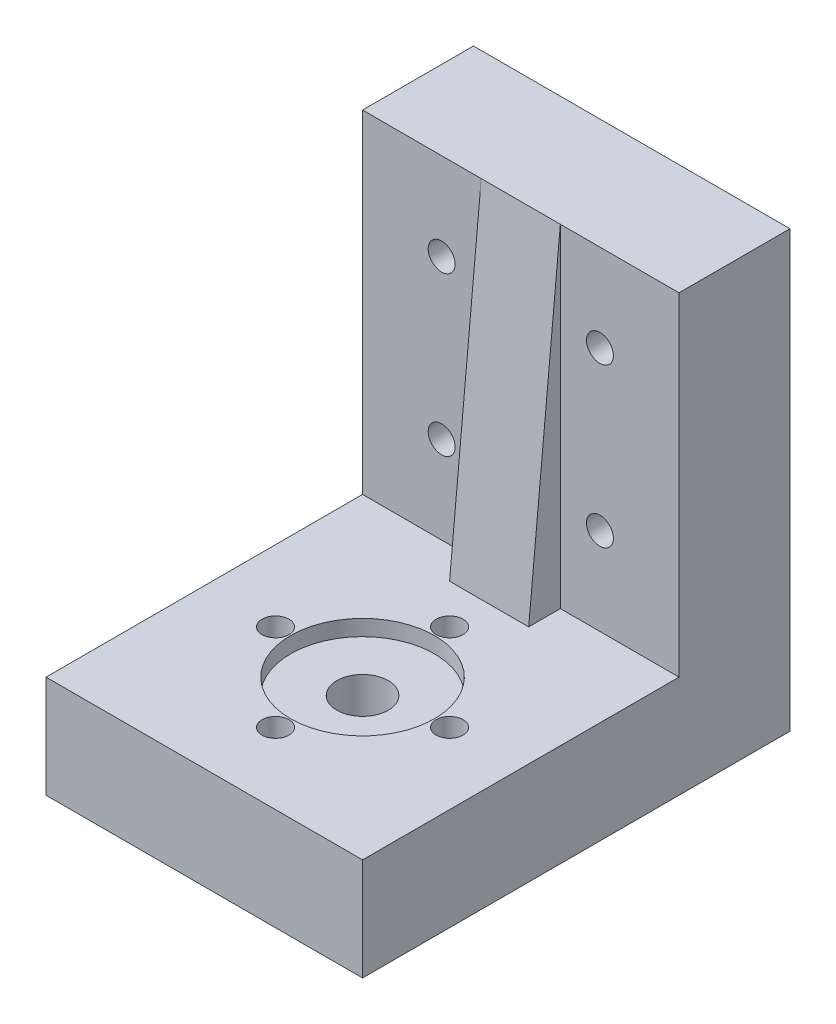
from build123d import *

# Parameters (mm, degrees)
BOSS_EXTRUDE1_DEPTH = 20
SKETCH2_R           = 3.25
CUT_EXTRUDE1_DEPTH  = 55.919366752
SKETCH3_R           = 9.1
CUT_EXTRUDE2_DEPTH  = 2
SKETCH4_R           = 1.7
CUT_EXTRUDE3_DEPTH  = 55.919366752
SKETCH5_R           = 1.7
CUT_EXTRUDE4_DEPTH  = 53.677895109
RIB26_REACH         = 46.958
SKETCH15_WALL_W     = 134.175527088
SKETCH15_WALL_H     = 10


with BuildPart() as part:
    # Sketch1 → Boss-Extrude1 (new, symmetric)
    with BuildSketch(Plane(origin=(0, 0, 0), x_dir=(0, 0, -1), z_dir=(1, 0, 0))):
        Polygon((24.929590164, 27.161885246), (24.929590164, -27.838114754), (-29.090409836, -27.838114754), (-29.090409836, -14.908114754), (10.909590164, -14.908114754), (10.909590164, 27.161885246), align=None)
    extrude(amount=BOSS_EXTRUDE1_DEPTH, both=True)

    # Sketch2 → Cut-Extrude1 (cut, through all)
    with BuildSketch(Plane(origin=(0, -14.908114754, 0), x_dir=(1, 0, 0), z_dir=(0, 1, 0))):
        with Locations(Location((0, -9.090409836, 0), (0, 0, 270))):
            Circle(SKETCH2_R)
    extrude(amount=-CUT_EXTRUDE1_DEPTH, mode=Mode.SUBTRACT)

    # Sketch3 → Cut-Extrude2 (cut)
    with BuildSketch(Plane(origin=(0, -14.908114754, 0), x_dir=(1, 0, 0), z_dir=(0, 1, 0))):
        with Locations(Location((0, -9.090409836, 0), (0, 0, 270))):
            Circle(SKETCH3_R)
    extrude(amount=-CUT_EXTRUDE2_DEPTH, mode=Mode.SUBTRACT)

    # Sketch4 → Cut-Extrude3 (cut, through all)
    with BuildSketch(Plane(origin=(0, -14.908114754, 0), x_dir=(1, 0, 0), z_dir=(0, 1, 0))):
        with Locations(Location((0, 1.909590164, 0), (0, 0, 270))):
            Circle(SKETCH4_R)
        with Locations(Location((11, -9.090409836, 0), (0, 0, 270))):
            Circle(SKETCH4_R)
        with Locations(Location((0, -20.090409836, 0), (0, 0, 270))):
            Circle(SKETCH4_R)
        with Locations(Location((-11, -9.090409836, 0), (0, 0, 270))):
            Circle(SKETCH4_R)
    extrude(amount=-CUT_EXTRUDE3_DEPTH, mode=Mode.SUBTRACT)

    # Sketch5 → Cut-Extrude4 (cut, through all)
    with BuildSketch(Plane.XY.offset(-10.909590164)):
        with Locations((-10, 16.126885246)):
            Circle(SKETCH5_R)
        with Locations((10, 16.126885246)):
            Circle(SKETCH5_R)
        with Locations((10, -3.873114754)):
            Circle(SKETCH5_R)
        with Locations((-10, -3.873114754)):
            Circle(SKETCH5_R)
    extrude(amount=-CUT_EXTRUDE4_DEPTH, mode=Mode.SUBTRACT)

    # Sketch15 wall → Rib26 (add, up to next)
    with BuildSketch(Plane(origin=(0, 6.126885246, -8.909590164), x_dir=(0, -0.995510349515, 0.094652754886), z_dir=(0, 0.094652754886, 0.995510349515)), mode=Mode.PRIVATE) as rib26_sk1:
        Rectangle(SKETCH15_WALL_W, SKETCH15_WALL_H)
    rib26_tool1 = extrude(rib26_sk1.sketch, amount=-RIB26_REACH, mode=Mode.PRIVATE) - part.part
    add(rib26_tool1.solids().sort_by_distance((0, 6.126885246, -8.909590164))[0])


solid = part.part
